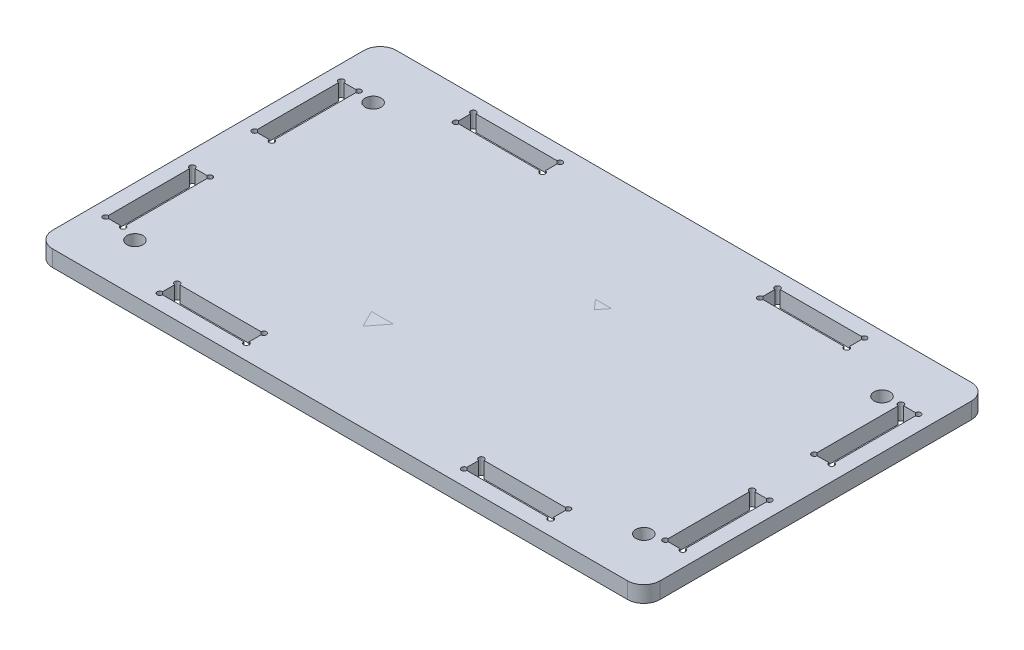
from build123d import *

# Parameters (mm, degrees)
SKETCH5_R              = 1.4732
BOSS_EXTRUDE1_DEPTH    = 3
BOSS_EXTRUDE2_DEPTH    = 0.2
SKETCH6_W              = 7.5
SKETCH6_H              = 1.875
BOSS_EXTRUDE2_2_DEPTH  = 0.2
BOSS_EXTRUDE2_3_DEPTH  = 0.2
BOSS_EXTRUDE2_4_DEPTH  = 0.2
BOSS_EXTRUDE2_5_DEPTH  = 0.2
BOSS_EXTRUDE2_6_DEPTH  = 0.2
BOSS_EXTRUDE2_7_DEPTH  = 0.2
BOSS_EXTRUDE2_8_DEPTH  = 0.2
BOSS_EXTRUDE2_9_DEPTH  = 0.2
BOSS_EXTRUDE2_10_DEPTH = 0.2
SKETCH6_H_2            = 7.5
BOSS_EXTRUDE2_11_DEPTH = 0.2
BOSS_EXTRUDE2_12_DEPTH = 0.2
BOSS_EXTRUDE2_13_DEPTH = 0.2
BOSS_EXTRUDE2_14_DEPTH = 0.2
BOSS_EXTRUDE2_15_DEPTH = 0.2
BOSS_EXTRUDE2_16_DEPTH = 0.2
BOSS_EXTRUDE2_17_DEPTH = 0.2
BOSS_EXTRUDE2_18_DEPTH = 0.2
SKETCH6_R              = 2
BOSS_EXTRUDE2_19_DEPTH = 0.2
SKETCH6_R_2            = 5
SKETCH6_R_3            = 3.5
BOSS_EXTRUDE2_20_DEPTH = 0.2


with BuildPart() as part:
    # Sketch5 → Boss-Extrude1 (new body)
    with BuildSketch(Plane(origin=(0, 0, 0), x_dir=(1, 0, 0), z_dir=(0, 1, 0))):
        with BuildLine():
            Line((-13.2, -6), (93, -6))
            ThreePointArc((93, -6), (95.121320344, -5.121320344), (96, -3))
            Line((96, -3), (96, 54.5))
            ThreePointArc((96, 54.5), (95.121320344, 56.621320344), (93, 57.5))
            Line((93, 57.5), (-13.2, 57.5))
            ThreePointArc((-13.2, 57.5), (-15.321320344, 56.621320344), (-16.2, 54.5))
            Line((-16.2, 54.5), (-16.2, -3))
            ThreePointArc((-16.2, -3), (-15.321320344, -5.121320344), (-13.2, -6))
        make_face()
        with Locations((-7, 3)):
            Circle(SKETCH5_R, mode=Mode.SUBTRACT)
        with Locations((-7, 47)):
            Circle(SKETCH5_R, mode=Mode.SUBTRACT)
        with Locations((87, 47)):
            Circle(SKETCH5_R, mode=Mode.SUBTRACT)
        with Locations((87, 3)):
            Circle(SKETCH5_R, mode=Mode.SUBTRACT)
        with BuildLine():
            Line((4.3, 54.7), (19.3, 54.7))
            ThreePointArc((19.3, 54.7), (20.153553391, 55.053553391), (19.8, 54.2))
            Line((19.8, 54.2), (19.8, 52))
            ThreePointArc((19.8, 52), (20.153553391, 51.146446609), (19.3, 51.5))
            Line((19.3, 51.5), (4.3, 51.5))
            ThreePointArc((4.3, 51.5), (3.446446609, 51.146446609), (3.8, 52))
            Line((3.8, 52), (3.8, 54.2))
            ThreePointArc((3.8, 54.2), (3.446446609, 55.053553391), (4.3, 54.7))
        make_face(mode=Mode.SUBTRACT)
        with BuildLine():
            Line((60.5, 54.7), (75.5, 54.7))
            ThreePointArc((75.5, 54.7), (76.353553391, 55.053553391), (76, 54.2))
            Line((76, 54.2), (76, 52))
            ThreePointArc((76, 52), (76.353553391, 51.146446609), (75.5, 51.5))
            Line((75.5, 51.5), (60.5, 51.5))
            ThreePointArc((60.5, 51.5), (59.646446609, 51.146446609), (60, 52))
            Line((60, 52), (60, 54.2))
            ThreePointArc((60, 54.2), (59.646446609, 55.053553391), (60.5, 54.7))
        make_face(mode=Mode.SUBTRACT)
        with BuildLine():
            Line((4.3, 0), (19.3, 0))
            ThreePointArc((19.3, 0), (20.153553391, 0.353553391), (19.8, -0.5))
            Line((19.8, -0.5), (19.8, -2.7))
            ThreePointArc((19.8, -2.7), (20.153553391, -3.553553391), (19.3, -3.2))
            Line((19.3, -3.2), (4.3, -3.2))
            ThreePointArc((4.3, -3.2), (3.446446609, -3.553553391), (3.8, -2.7))
            Line((3.8, -2.7), (3.8, -0.5))
            ThreePointArc((3.8, -0.5), (3.446446609, 0.353553391), (4.3, 0))
        make_face(mode=Mode.SUBTRACT)
        with BuildLine():
            Line((60.5, 0), (75.5, 0))
            ThreePointArc((75.5, 0), (76.353553391, 0.353553391), (76, -0.5))
            Line((76, -0.5), (76, -2.7))
            ThreePointArc((76, -2.7), (76.353553391, -3.553553391), (75.5, -3.2))
            Line((75.5, -3.2), (60.5, -3.2))
            ThreePointArc((60.5, -3.2), (59.646446609, -3.553553391), (60, -2.7))
            Line((60, -2.7), (60, -0.5))
            ThreePointArc((60, -0.5), (59.646446609, 0.353553391), (60.5, 0))
        make_face(mode=Mode.SUBTRACT)
        with BuildLine():
            Line((-13.4, 32), (-13.4, 47))
            ThreePointArc((-13.4, 47), (-13.753553391, 47.853553391), (-12.9, 47.5))
            Line((-12.9, 47.5), (-10.7, 47.5))
            ThreePointArc((-10.7, 47.5), (-9.846446609, 47.853553391), (-10.2, 47))
            Line((-10.2, 47), (-10.2, 32))
            ThreePointArc((-10.2, 32), (-9.846446609, 31.146446609), (-10.7, 31.5))
            Line((-10.7, 31.5), (-12.9, 31.5))
            ThreePointArc((-12.9, 31.5), (-13.753553391, 31.146446609), (-13.4, 32))
        make_face(mode=Mode.SUBTRACT)
        with BuildLine():
            Line((-13.4, 4.5), (-13.4, 19.5))
            ThreePointArc((-13.4, 19.5), (-13.753553391, 20.353553391), (-12.9, 20))
            Line((-12.9, 20), (-10.7, 20))
            ThreePointArc((-10.7, 20), (-9.846446609, 20.353553391), (-10.2, 19.5))
            Line((-10.2, 19.5), (-10.2, 4.5))
            ThreePointArc((-10.2, 4.5), (-9.846446609, 3.646446609), (-10.7, 4))
            Line((-10.7, 4), (-12.9, 4))
            ThreePointArc((-12.9, 4), (-13.753553391, 3.646446609), (-13.4, 4.5))
        make_face(mode=Mode.SUBTRACT)
        with BuildLine():
            Line((90, 32), (90, 47))
            ThreePointArc((90, 47), (89.646446609, 47.853553391), (90.5, 47.5))
            Line((90.5, 47.5), (92.7, 47.5))
            ThreePointArc((92.7, 47.5), (93.553553391, 47.853553391), (93.2, 47))
            Line((93.2, 47), (93.2, 32))
            ThreePointArc((93.2, 32), (93.553553391, 31.146446609), (92.7, 31.5))
            Line((92.7, 31.5), (90.5, 31.5))
            ThreePointArc((90.5, 31.5), (89.646446609, 31.146446609), (90, 32))
        make_face(mode=Mode.SUBTRACT)
        with BuildLine():
            Line((90, 4.5), (90, 19.5))
            ThreePointArc((90, 19.5), (89.646446609, 20.353553391), (90.5, 20))
            Line((90.5, 20), (92.7, 20))
            ThreePointArc((92.7, 20), (93.553553391, 20.353553391), (93.2, 19.5))
            Line((93.2, 19.5), (93.2, 4.5))
            ThreePointArc((93.2, 4.5), (93.553553391, 3.646446609), (92.7, 4))
            Line((92.7, 4), (90.5, 4))
            ThreePointArc((90.5, 4), (89.646446609, 3.646446609), (90, 4.5))
        make_face(mode=Mode.SUBTRACT)
    extrude(amount=BOSS_EXTRUDE1_DEPTH)


with BuildPart() as body_2:
    # Sketch6 → Boss-Extrude2 (new body)
    with BuildSketch(Plane(origin=(0, 3, 0), x_dir=(1, 0, 0), z_dir=(0, 1, 0))):
        Polygon((10, 11.5625), (6.25, 4.0625), (13.75, 4.0625), align=None)
    extrude(amount=-BOSS_EXTRUDE2_DEPTH)


with BuildPart() as body_3:
    # Sketch6 → Boss-Extrude2 2 (new body)
    with BuildSketch(Plane(origin=(0, 3, 0), x_dir=(1, 0, 0), z_dir=(0, 1, 0))):
        with Locations((10, 20)):
            Rectangle(SKETCH6_W, SKETCH6_H)
    extrude(amount=-BOSS_EXTRUDE2_2_DEPTH)


with BuildPart() as body_4:
    # Sketch6 → Boss-Extrude2 3 (new body)
    with BuildSketch(Plane(origin=(0, 3, 0), x_dir=(1, 0, 0), z_dir=(0, 1, 0))):
        with Locations((10, 16.25)):
            Rectangle(SKETCH6_W, SKETCH6_H)
    extrude(amount=-BOSS_EXTRUDE2_3_DEPTH)


with BuildPart() as body_5:
    # Sketch6 → Boss-Extrude2 4 (new body)
    with BuildSketch(Plane(origin=(0, 3, 0), x_dir=(1, 0, 0), z_dir=(0, 1, 0))):
        Polygon((26.25, 44.0625), (30, 44.0625), (33.75, 44.0625), (33.75, 45.9375), (26.25, 45.9375), align=None)
    extrude(amount=-BOSS_EXTRUDE2_4_DEPTH)


with BuildPart() as body_6:
    # Sketch6 → Boss-Extrude2 5 (new body)
    with BuildSketch(Plane(origin=(0, 3, 0), x_dir=(1, 0, 0), z_dir=(0, 1, 0))):
        Polygon((26.25, 36.5625), (30, 36.5625), (33.75, 36.5625), (30, 44.0625), align=None)
    extrude(amount=-BOSS_EXTRUDE2_5_DEPTH)


with BuildPart() as body_7:
    # Sketch6 → Boss-Extrude2 6 (new body)
    with BuildSketch(Plane(origin=(0, 3, 0), x_dir=(1, 0, 0), z_dir=(0, 1, 0))):
        Polygon((30, 36.5625), (26.25, 29.0625), (33.75, 29.0625), align=None)
    extrude(amount=-BOSS_EXTRUDE2_6_DEPTH)


with BuildPart() as body_8:
    # Sketch6 → Boss-Extrude2 7 (new body)
    with BuildSketch(Plane(origin=(0, 3, 0), x_dir=(1, 0, 0), z_dir=(0, 1, 0))):
        Polygon((33.75, 5.9375), (30, 5.9375), (26.25, 5.9375), (26.25, 4.0625), (33.75, 4.0625), align=None)
    extrude(amount=-BOSS_EXTRUDE2_7_DEPTH)


with BuildPart() as body_9:
    # Sketch6 → Boss-Extrude2 8 (new body)
    with BuildSketch(Plane(origin=(0, 3, 0), x_dir=(1, 0, 0), z_dir=(0, 1, 0))):
        Polygon((33.75, 13.437499848), (30.000000304, 13.4375), (26.25, 13.437500152), (30, 5.9375), align=None)
    extrude(amount=-BOSS_EXTRUDE2_8_DEPTH)


with BuildPart() as body_10:
    # Sketch6 → Boss-Extrude2 9 (new body)
    with BuildSketch(Plane(origin=(0, 3, 0), x_dir=(1, 0, 0), z_dir=(0, 1, 0))):
        Polygon((30.000000304, 13.4375), (33.75, 20.937499848), (26.25, 20.937500152), align=None)
    extrude(amount=-BOSS_EXTRUDE2_9_DEPTH)


with BuildPart() as body_11:
    # Sketch6 → Boss-Extrude2 10 (new body)
    with BuildSketch(Plane(origin=(0, 3, 0), x_dir=(1, 0, 0), z_dir=(0, 1, 0))):
        Polygon((45, 36.062704137), (48, 32.64), (48, 30.64), (52, 30.64), (52, 32.64), (55, 36.062704137), align=None)
    extrude(amount=-BOSS_EXTRUDE2_10_DEPTH)


with BuildPart() as body_12:
    # Sketch6 → Boss-Extrude2 11 (new body)
    with BuildSketch(Plane(origin=(0, 3, 0), x_dir=(1, 0, 0), z_dir=(0, 1, 0))):
        with Locations((10, 37.5)):
            Rectangle(SKETCH6_W, SKETCH6_H_2)
    extrude(amount=-BOSS_EXTRUDE2_11_DEPTH)


with BuildPart() as body_13:
    # Sketch6 → Boss-Extrude2 12 (new body)
    with BuildSketch(Plane(origin=(0, 3, 0), x_dir=(1, 0, 0), z_dir=(0, 1, 0))):
        Polygon((45, 13.922704137), (48, 10.5), (48, 8.5), (52, 8.5), (52, 10.5), (55, 13.922704137), align=None)
    extrude(amount=-BOSS_EXTRUDE2_12_DEPTH)


with BuildPart() as body_14:
    # Sketch6 → Boss-Extrude2 13 (new body)
    with BuildSketch(Plane(origin=(0, 3, 0), x_dir=(1, 0, 0), z_dir=(0, 1, 0))):
        with BuildLine():
            Line((70, 7.5), (70, 9))
            ThreePointArc((70, 9), (66.648495178, 11.49132987), (68.068249827, 15.418619754))
            Line((68.068249827, 15.418619754), (68.482196292, 14.793201235))
            Line((68.482196292, 14.793201235), (68.905140398, 16.871931204))
            Line((68.905140398, 16.871931204), (66.826410429, 17.29487531))
            Line((66.826410429, 17.29487531), (67.240356895, 16.669456791))
            ThreePointArc((67.240356895, 16.669456791), (65.212135969, 11.059042672), (70, 7.5))
        make_face()
    extrude(amount=-BOSS_EXTRUDE2_13_DEPTH)


with BuildPart() as body_15:
    # Sketch6 → Boss-Extrude2 14 (new body)
    with BuildSketch(Plane(origin=(0, 3, 0), x_dir=(1, 0, 0), z_dir=(0, 1, 0))):
        with BuildLine():
            ThreePointArc((72.759643105, 8.330543209), (74.787864031, 13.940957328), (70, 17.5))
            Line((70, 17.5), (70, 16))
            ThreePointArc((70, 16), (73.351504822, 13.50867013), (71.931750173, 9.581380246))
            Line((71.931750173, 9.581380246), (71.517803708, 10.206798765))
            Line((71.517803708, 10.206798765), (71.094859602, 8.128068796))
            Line((71.094859602, 8.128068796), (73.173589571, 7.70512469))
            Line((73.173589571, 7.70512469), (72.759643105, 8.330543209))
        make_face()
    extrude(amount=-BOSS_EXTRUDE2_14_DEPTH)


with BuildPart() as body_16:
    # Sketch6 → Boss-Extrude2 15 (new body)
    with BuildSketch(Plane(origin=(0, 3, 0), x_dir=(1, 0, 0), z_dir=(0, 1, 0))):
        with BuildLine():
            ThreePointArc((52.35, 37.479529156), (50.003751117, 38.493315991), (47.65, 37.497071421))
            ThreePointArc((47.65, 37.497071421), (47.642928579, 36.79), (48.35, 36.782928579))
            ThreePointArc((48.35, 36.782928579), (50.003829046, 37.494466561), (51.65, 36.765386314))
            ThreePointArc((51.65, 36.765386314), (52.357071421, 36.772457735), (52.35, 37.479529156))
        make_face()
    extrude(amount=-BOSS_EXTRUDE2_15_DEPTH)


with BuildPart() as body_17:
    # Sketch6 → Boss-Extrude2 16 (new body)
    with BuildSketch(Plane(origin=(0, 3, 0), x_dir=(1, 0, 0), z_dir=(0, 1, 0))):
        with BuildLine():
            ThreePointArc((53.35, 39.979529156), (50.003619768, 41.370815325), (46.65, 39.997071421))
            ThreePointArc((46.65, 39.997071421), (46.642928579, 39.29), (47.35, 39.282928579))
            ThreePointArc((47.35, 39.282928579), (50.003629954, 40.370866104), (52.65, 39.265386314))
            ThreePointArc((52.65, 39.265386314), (53.357071421, 39.272457735), (53.35, 39.979529156))
        make_face()
    extrude(amount=-BOSS_EXTRUDE2_16_DEPTH)


with BuildPart() as body_18:
    # Sketch6 → Boss-Extrude2 17 (new body)
    with BuildSketch(Plane(origin=(0, 3, 0), x_dir=(1, 0, 0), z_dir=(0, 1, 0))):
        with BuildLine():
            ThreePointArc((54.35, 42.479529156), (50.003765563, 44.355812607), (45.65, 42.497071421))
            ThreePointArc((45.65, 42.497071421), (45.642928579, 41.79), (46.35, 41.782928579))
            ThreePointArc((46.35, 41.782928579), (50.003803478, 43.356928408), (53.65, 41.765386314))
            ThreePointArc((53.65, 41.765386314), (54.357071421, 41.772457735), (54.35, 42.479529156))
        make_face()
    extrude(amount=-BOSS_EXTRUDE2_17_DEPTH)


with BuildPart() as body_19:
    # Sketch6 → Boss-Extrude2 18 (new body)
    with BuildSketch(Plane(origin=(0, 3, 0), x_dir=(1, 0, 0), z_dir=(0, 1, 0))):
        with BuildLine():
            ThreePointArc((52.35, 15.339529156), (50.003751117, 16.353315991), (47.65, 15.357071421))
            ThreePointArc((47.65, 15.357071421), (47.642928579, 14.65), (48.35, 14.642928579))
            ThreePointArc((48.35, 14.642928579), (50.003829046, 15.354466561), (51.65, 14.625386314))
            ThreePointArc((51.65, 14.625386314), (52.357071421, 14.632457735), (52.35, 15.339529156))
        make_face()
    extrude(amount=-BOSS_EXTRUDE2_18_DEPTH)


with BuildPart() as body_20:
    # Sketch6 → Boss-Extrude2 19 (new body)
    with BuildSketch(Plane(origin=(0, 3, 0), x_dir=(1, 0, 0), z_dir=(0, 1, 0))):
        with Locations((70, 37.5)):
            Circle(SKETCH6_R)
    extrude(amount=-BOSS_EXTRUDE2_19_DEPTH)


with BuildPart() as body_21:
    # Sketch6 → Boss-Extrude2 20 (new body)
    with BuildSketch(Plane(origin=(0, 3, 0), x_dir=(1, 0, 0), z_dir=(0, 1, 0))):
        with Locations((70, 37.5)):
            Circle(SKETCH6_R_2)
        with Locations((70, 37.5)):
            Circle(SKETCH6_R_3, mode=Mode.SUBTRACT)
    extrude(amount=-BOSS_EXTRUDE2_20_DEPTH)


solid = Compound([part.part, body_2.part, body_3.part, body_4.part, body_5.part, body_6.part, body_7.part, body_8.part, body_9.part, body_10.part, body_11.part, body_12.part, body_13.part, body_14.part, body_15.part, body_16.part, body_17.part, body_18.part, body_19.part, body_20.part, body_21.part])
